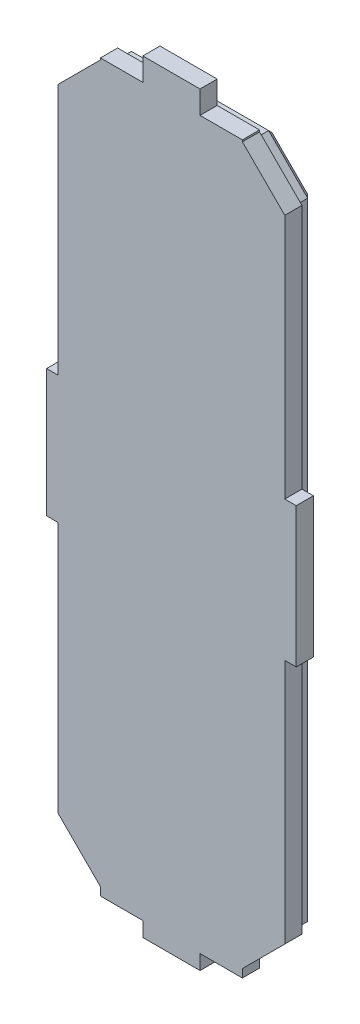
from build123d import *

# Parameters (mm, degrees)
BOSS_EXTRUDE1_DEPTH = 1.5
BOSS_EXTRUDE2_DEPTH = 1.5
SKETCH3_W           = 2
SKETCH3_H           = 12.202692118
SKETCH3_H_2         = 11.147562167
BOSS_EXTRUDE3_DEPTH = 1.5
CHAMFER2_SIZE       = 0.5


with BuildPart() as part:
    # Sketch1 → Boss-Extrude1 (new body)
    with BuildSketch(Plane.XY):
        Polygon((-135.194999999, -141.317867967), (-131.782867965, -144.730000001), (-119.797132034, -144.730000001), (-116.384999999, -141.317867967), (-116.384999999, -86.586255973), (-119.797132034, -83.174123939), (-131.782867965, -83.174123939), (-135.194999999, -86.586255973), align=None)
    extrude(amount=-BOSS_EXTRUDE1_DEPTH)

    # Sketch2 → Boss-Extrude2 (add)
    with BuildSketch(Plane.XY):
        Polygon((-135.694999999, -86.379149192), (-135.694999999, -141.524974748), (-131.989974746, -145.230000001), (-119.590025252, -145.230000001), (-115.884999999, -141.524974748), (-115.884999999, -86.379149192), (-119.590025252, -82.674123939), (-131.989974746, -82.674123939), align=None)
    extrude(amount=BOSS_EXTRUDE2_DEPTH)

    # Sketch3 → Boss-Extrude3 (add)
    with BuildSketch(Plane.XY.offset(1.5)):
        Polygon((-131.989974746, -83.526014077), (-128.289999999, -83.526014077), (-128.289999999, -84.5222338), (-123.289999999, -84.5222338), (-123.289999999, -83.526014077), (-119.590025252, -83.526014077), (-119.590025252, -82.5222338), (-123.289999999, -82.5222338), (-123.289999999, -80.5222338), (-128.289999999, -80.5222338), (-128.289999999, -82.5222338), (-131.989974746, -82.5222338), align=None)
        Polygon((-131.989974746, -143.816923353), (-128.289999999, -143.816923353), (-128.289999999, -143.230000001), (-123.289999999, -143.230000001), (-123.289999999, -143.816923353), (-119.590025252, -143.816923353), (-119.590025252, -145.943076649), (-123.289999999, -145.943076649), (-123.289999999, -147.230000001), (-128.289999999, -147.230000001), (-128.289999999, -145.943076649), (-131.989974746, -145.943076649), align=None)
        with Locations((-115.884999999, -113.95206197)):
            Rectangle(SKETCH3_W, SKETCH3_H)
        with Locations((-135.694999999, -113.95206197)):
            Rectangle(SKETCH3_W, SKETCH3_H_2)
    extrude(amount=-BOSS_EXTRUDE3_DEPTH)

    # Chamfer2
    chamfer2_edges = [part.edges().sort_by_distance(p)[0] for p in [
        (-125.789999999, -144.730000001, -1.5),
        (-118.091066016, -143.023933984, -1.5),
        (-116.384999999, -113.95206197, -1.5),
        (-118.091066016, -84.880189956, -1.5),
        (-125.789999999, -83.174123939, -1.5),
        (-133.488933982, -84.880189956, -1.5),
        (-135.194999999, -113.95206197, -1.5),
        (-133.488933982, -143.023933984, -1.5),
    ]]
    chamfer(chamfer2_edges, length=CHAMFER2_SIZE)


solid = part.part
